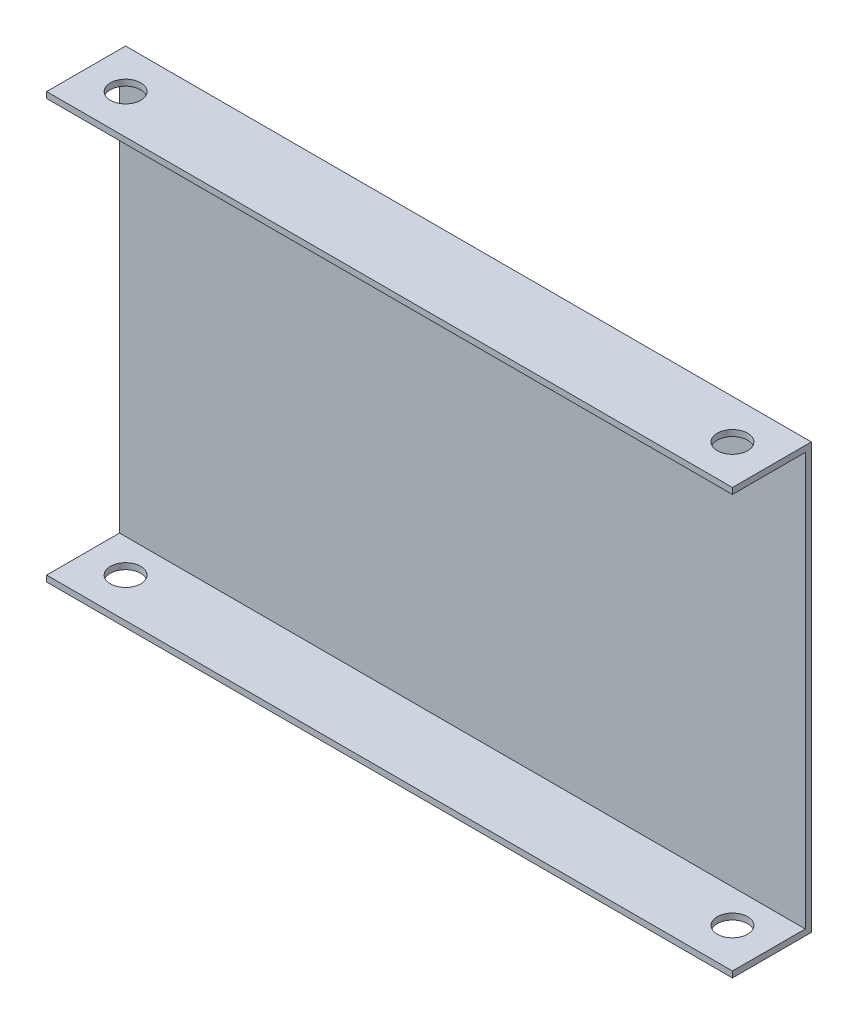
from build123d import *

# Parameters (mm, degrees)
SKETCH3_W               = 287.02
SKETCH3_H               = 177.8
BOSS_EXTRUDE1_DEPTH     = 33.02
SKETCH4_W               = 281.94
SKETCH4_H               = 172.72
CUT_EXTRUDE1_DEPTH      = 30.48
CUT_EXTRUDE2_DEPTH      = 300.87064011
CUT_EXTRUDE2_DEPTH_BACK = 300.87064011
SKETCH5_W               = 30.48
SKETCH5_H               = 172.72
CUT_EXTRUDE3_DEPTH      = 229.913756904
CUT_EXTRUDE3_DEPTH_BACK = 229.913756904
SKETCH6_R               = 6.35


with BuildPart() as part:
    # Sketch3 → Boss-Extrude1 (new body)
    with BuildSketch(Plane.XY):
        Rectangle(SKETCH3_W, SKETCH3_H)
    extrude(amount=BOSS_EXTRUDE1_DEPTH)

    # Sketch4 → Cut-Extrude1 (cut)
    with BuildSketch(Plane.XY.offset(33.02)):
        Rectangle(SKETCH4_W, SKETCH4_H)
    extrude(amount=-CUT_EXTRUDE1_DEPTH, mode=Mode.SUBTRACT)

    # Sketch5 → Cut-Extrude2 (cut, two sides: drawn at the far end of the back side and taken through both)
    with BuildSketch(Plane(origin=(-140.97, 0, 0), x_dir=(0, 0, -1), z_dir=(1, 0, 0)).offset(-CUT_EXTRUDE2_DEPTH_BACK)):
        with Locations((-17.78, 0)):
            Rectangle(SKETCH5_W, SKETCH5_H)
    extrude(amount=CUT_EXTRUDE2_DEPTH + CUT_EXTRUDE2_DEPTH_BACK, mode=Mode.SUBTRACT)

    # Sketch6 → Cut-Extrude3 (cut, two sides: drawn at the far end of the back side and taken through both)
    with BuildSketch(Plane(origin=(0, -86.36, 0), x_dir=(1, 0, 0), z_dir=(0, 1, 0)).offset(-CUT_EXTRUDE3_DEPTH_BACK)):
        with Locations(Location((127, -16.51, 0), (0, 0, 270))):
            Circle(SKETCH6_R)
        with Locations(Location((-127, -16.51, 0), (0, 0, 270))):
            Circle(SKETCH6_R)
    extrude(amount=CUT_EXTRUDE3_DEPTH + CUT_EXTRUDE3_DEPTH_BACK, mode=Mode.SUBTRACT)


solid = part.part
